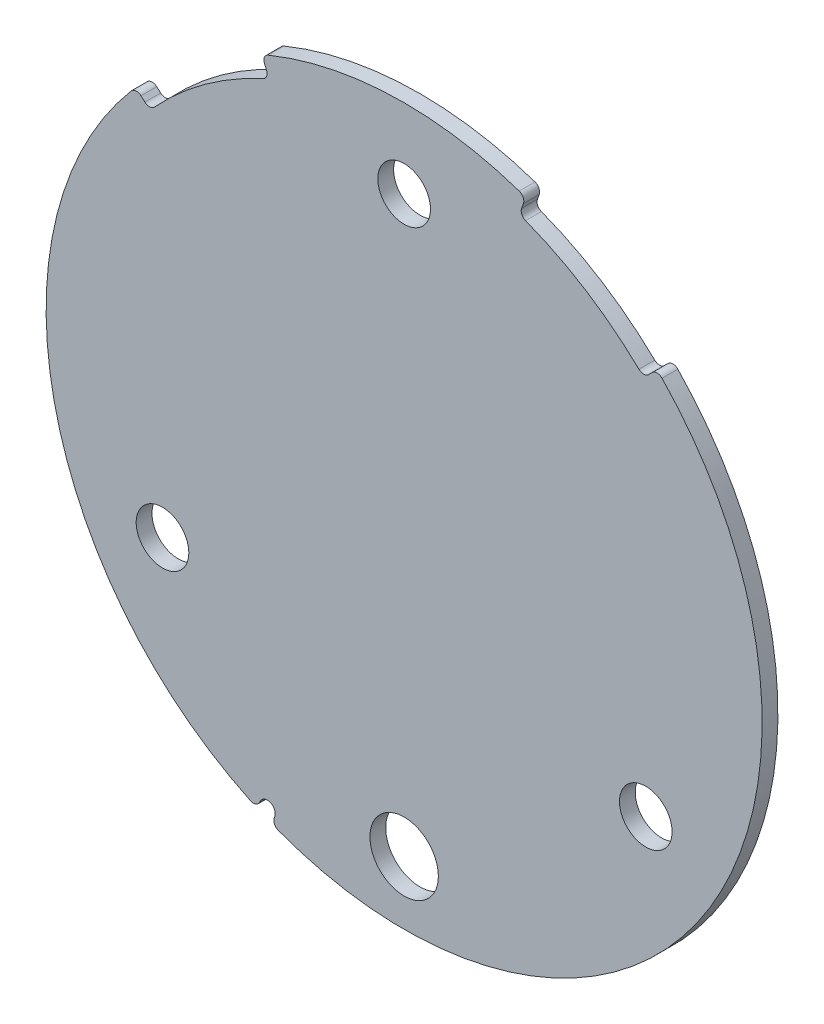
from build123d import *

# Parameters (mm, degrees)
SALIENTE_EXTRUIR2_DEPTH = 1.5
CROQUIS5_R              = 34.003076767
CROQUIS5_R_2            = 3.25
SALIENTE_EXTRUIR3_DEPTH = 1.5
CORTAR_EXTRUIR6_DEPTH   = 1.5
REDONDEO2_R             = 0.65
CORTAR_EXTRUIR7_START   = -1.5
CORTAR_EXTRUIR7_DEPTH   = 1.5
REDONDEO3_R             = 0.65
CORTAR_EXTRUIR8_START   = -1.5
CORTAR_EXTRUIR8_DEPTH   = 1.5
REDONDEO4_R             = 0.65
CROQUIS9_R              = 2.5
CORTAR_EXTRUIR10_DEPTH  = 49.111001436


with BuildPart() as part:
    # Croquis3 → Saliente-Extruir2 (new body)
    with BuildSketch(Plane.XY):
        with BuildLine():
            Line((-5.157307796, -27.019308404), (-6.280793024, -32.905285166))
            ThreePointArc((-6.280793024, -32.905285166), (-6.494024336, -33.227196877), (-6.872990522, -33.301219661))
            ThreePointArc((-6.872990522, -33.301219661), (0, 34.003076767), (6.872990522, -33.301219661))
            ThreePointArc((6.872990522, -33.301219661), (6.494024336, -33.227196877), (6.280793024, -32.905285166))
            Line((6.280793024, -32.905285166), (5.157307796, -27.019308404))
            ThreePointArc((5.157307796, -27.019308404), (0, -22.753293006), (-5.157307796, -27.019308404))
        make_face()
    extrude(amount=SALIENTE_EXTRUIR2_DEPTH)

    # Croquis5 → Saliente-Extruir3 (add)
    with BuildSketch(Plane.XY):
        with Locations(Location((0, 0, 0), (0, 0, 180))):
            Circle(CROQUIS5_R)
        with Locations((0, -28.003709015)):
            Circle(CROQUIS5_R_2, mode=Mode.SUBTRACT)
    extrude(amount=SALIENTE_EXTRUIR3_DEPTH)

    # Croquis4 → Cortar-Extruir6 (cut)
    with BuildSketch(Plane.XY):
        with BuildLine():
            ThreePointArc((10.940986169, 30.28750526), (17.262989212, 27.1850576), (22.759447155, 22.782574886))
            Line((22.759447155, 22.782574886), (24.031592832, 24.056013293))
            ThreePointArc((24.031592832, 24.056013293), (18.227908832, 28.704574012), (11.552535657, 31.980433854))
            Line((11.552535657, 31.980433854), (10.940986169, 30.28750526))
        make_face()
    extrude(amount=CORTAR_EXTRUIR6_DEPTH, mode=Mode.SUBTRACT)

    # Redondeo2
    redondeo2_edges = [part.edges().sort_by_distance(p)[0] for p in [
        (11.552535657, 31.980433854, 0.75),
        (10.940986169, 30.28750526, 0.75),
        (22.759447155, 22.782574886, 0.75),
        (24.031592832, 24.056013293, 0.75),
    ]]
    fillet(redondeo2_edges, radius=REDONDEO2_R)

    # Croquis6 → Cortar-Extruir7 (cut)
    with BuildSketch(Plane.XY.offset(1.5).offset(CORTAR_EXTRUIR7_START)):
        with BuildLine():
            Line((-24.137163622, 21.312844303), (-25.488752409, 22.506282018))
            ThreePointArc((-25.488752409, 22.506282018), (-19.986507056, 27.509066965), (-13.528288511, 31.196067694))
            Line((-13.528288511, 31.196067694), (-12.8109257, 29.541837835))
            ThreePointArc((-12.8109257, 29.541837835), (-18.926685124, 26.050347219), (-24.137163622, 21.312844303))
        make_face()
    extrude(amount=CORTAR_EXTRUIR7_DEPTH, mode=Mode.SUBTRACT)

    # Redondeo3
    redondeo3_edges = [part.edges().sort_by_distance(p)[0] for p in [
        (-12.8109257, 29.541837835, 0.75),
        (-24.137163622, 21.312844303, 0.75),
        (-25.488752409, 22.506282018, 0.75),
        (-13.528288511, 31.196067694, 0.75),
    ]]
    fillet(redondeo3_edges, radius=REDONDEO3_R)

    # Croquis7 → Cortar-Extruir8 (cut)
    with BuildSketch(Plane.XY.offset(1.5).offset(CORTAR_EXTRUIR8_START)):
        with BuildLine():
            Line((-13.67660573, -30.301073746), (-13.98863049, -30.992377234))
            ThreePointArc((-13.98863049, -30.992377234), (-13.286060557, -31.299997196), (-12.57673119, -31.59169293))
            Line((-12.57673119, -31.59169293), (-12.296199688, -30.887021347))
            ThreePointArc((-12.296199688, -30.887021347), (-12.699963864, -29.919239916), (-13.67660573, -30.301073746))
        make_face()
    extrude(amount=CORTAR_EXTRUIR8_DEPTH, mode=Mode.SUBTRACT)

    # Redondeo4
    redondeo4_edges = [part.edges().sort_by_distance(p)[0] for p in [
        (-12.57673119, -31.59169293, 0.75),
        (-13.98863049, -30.992377234, 0.75),
    ]]
    fillet(redondeo4_edges, radius=REDONDEO4_R)

    # Croquis9 → Cortar-Extruir10 (cut, through all)
    with BuildSketch(Plane.XY):
        with Locations((-22.9496732, -13.25)):
            Circle(CROQUIS9_R)
        with Locations((22.9496732, -13.25)):
            Circle(CROQUIS9_R)
        with Locations((0, 26.5)):
            Circle(CROQUIS9_R)
    extrude(amount=CORTAR_EXTRUIR10_DEPTH, mode=Mode.SUBTRACT)


solid = part.part
